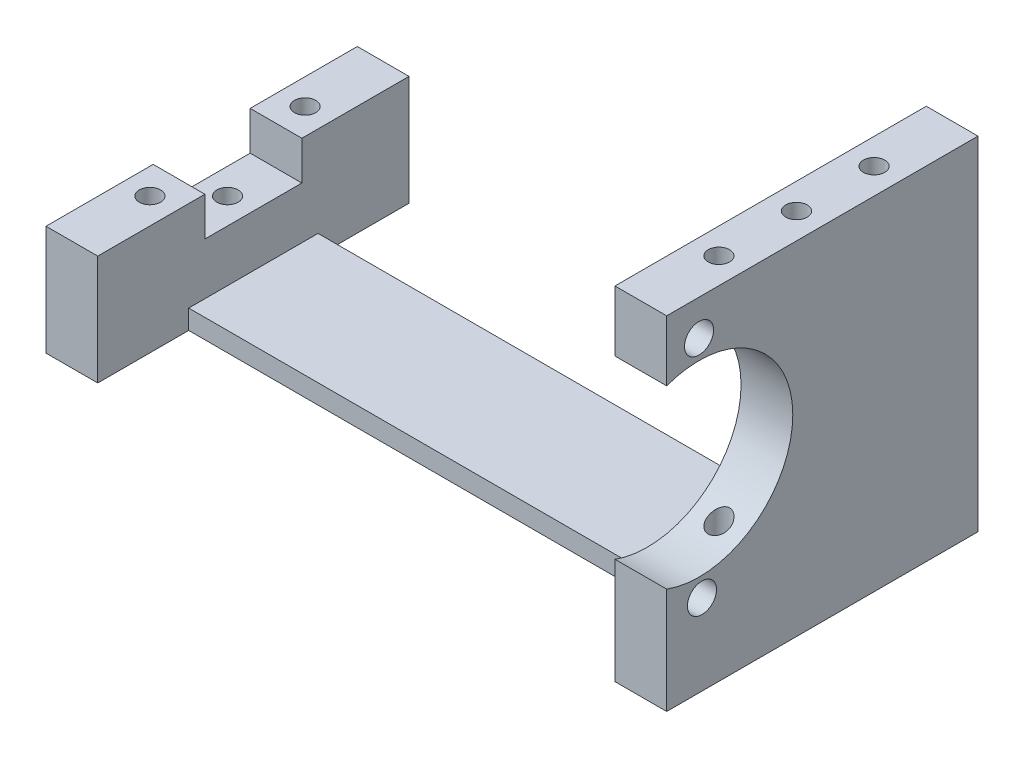
from build123d import *

# Parameters (mm, degrees)
SKETCH_1_W          = 8
SKETCH_1_H          = 48.14748393
SKETCH_1_R          = 1.65
EXTRUDE_1_DEPTH     = 53
EXTRUDE_1_2_DEPTH   = 53
SKETCH_2_W          = 20
SKETCH_2_H          = 3
EXTRUDE_2_DEPTH     = 80
SKETCH_3_R          = 14.5
SKETCH_3_R_2        = 2.25
CUT_EXTRUDE_1_DEPTH = 20
SKETCH_4_W          = 48.14748393
SKETCH_4_H          = 36
CUT_EXTRUDE_2_DEPTH = 15
SKETCH_6_W          = 8
SKETCH_6_H          = 15
CUT_EXTRUDE_4_DEPTH = 6


with BuildPart() as part:
    # 草图1 → 凸台-拉伸1 (new body)
    with BuildSketch(Plane(origin=(0, 0, 0), x_dir=(1, 0, 0), z_dir=(0, 1, 0))):
        with Locations((44, 0)):
            Rectangle(SKETCH_1_W, SKETCH_1_H)
        with Locations(Location((44, 0, 0), (0, 0, 90))):
            Circle(SKETCH_1_R, mode=Mode.SUBTRACT)
        with Locations(Location((44, -12, 0), (0, 0, 90))):
            Circle(SKETCH_1_R, mode=Mode.SUBTRACT)
        with Locations(Location((44, 12, 0), (0, 0, 270))):
            Circle(SKETCH_1_R, mode=Mode.SUBTRACT)
    extrude(amount=EXTRUDE_1_DEPTH)



with BuildPart() as body_2:
    # 草图1 → Extrude 1 2 (new body)
    with BuildSketch(Plane(origin=(0, 0, 0), x_dir=(1, 0, 0), z_dir=(0, 1, 0))):
        with Locations((-44, 0)):
            Rectangle(SKETCH_1_W, SKETCH_1_H)
        with Locations(Location((-44, 0, 0), (0, 0, 270))):
            Circle(SKETCH_1_R, mode=Mode.SUBTRACT)
        with Locations(Location((-44, -12, 0), (0, 0, 270))):
            Circle(SKETCH_1_R, mode=Mode.SUBTRACT)
        with Locations(Location((-44, 12, 0), (0, 0, 90))):
            Circle(SKETCH_1_R, mode=Mode.SUBTRACT)
    extrude(amount=EXTRUDE_1_2_DEPTH)


with BuildPart() as part_1:
    add(part.part)

    add(body_2.part)  # 凸台-拉伸2 merges body 2
    # 草图2 → 凸台-拉伸2 (add)
    with BuildSketch(Plane(origin=(-40, 0, 0), x_dir=(0, 0, -1), z_dir=(1, 0, 0))):
        with Locations((0, 1.5)):
            Rectangle(SKETCH_2_W, SKETCH_2_H)
    extrude(amount=EXTRUDE_2_DEPTH)

    # 草图3 → 切除-拉伸1 (cut)
    with BuildSketch(Plane(origin=(48, 0, 0), x_dir=(0, 0, -1), z_dir=(1, 0, 0))):
        with Locations((-19.073741965, 30)):
            Circle(SKETCH_3_R)
        with Locations((-19.073741965, 47.5)):
            Circle(SKETCH_3_R_2)
        with Locations((-18.617981623, 12.505935792)):
            Circle(SKETCH_3_R_2)
    extrude(amount=-CUT_EXTRUDE_1_DEPTH, mode=Mode.SUBTRACT)

    # 草图4 → 切除-拉伸2 (cut)
    with BuildSketch(Plane.ZY.offset(48)):
        with Locations((0, 35)):
            Rectangle(SKETCH_4_W, SKETCH_4_H)
    extrude(amount=-CUT_EXTRUDE_2_DEPTH, mode=Mode.SUBTRACT)

    # 草图6 → 切除-拉伸4 (cut)
    with BuildSketch(Plane(origin=(0, 17, 0), x_dir=(1, 0, 0), z_dir=(0, 1, 0))):
        with Locations((-44, 0)):
            Rectangle(SKETCH_6_W, SKETCH_6_H)
    extrude(amount=-CUT_EXTRUDE_4_DEPTH, mode=Mode.SUBTRACT)


solid = part_1.part
